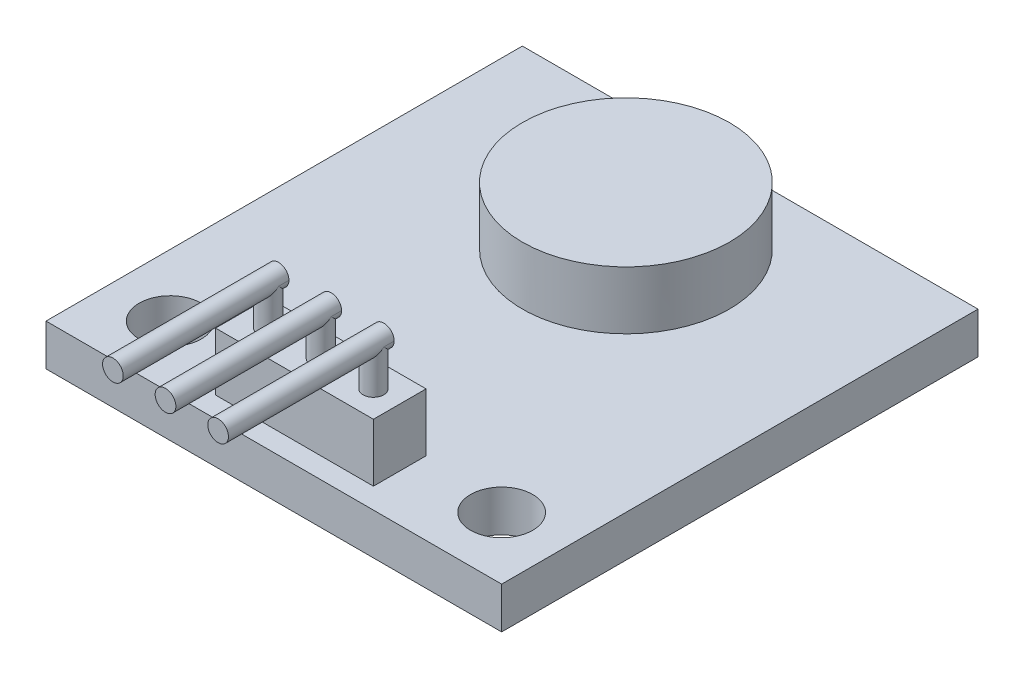
from build123d import *

# Parameters (mm, degrees)
SKETCH_1_W      = 22
SKETCH_1_H      = 23
SKETCH_1_R      = 1.5
EXTRUDE_1_DEPTH = 2
SKETCH_2_R      = 5
SKETCH_2_W      = 7.62
SKETCH_2_H      = 2.54
EXTRUDE_2_DEPTH = 2.8
SKETCH_3_R      = 0.5
EXTRUDE_3_DEPTH = 2
EXTRUDE_START   = -1.77
SKETCH_4_R      = 0.5
EXTRUDE_4_DEPTH = 8


with BuildPart() as part:
    # 草图1 → 凸台-拉伸1 (new body)
    with BuildSketch(Plane(origin=(0, 0, 0), x_dir=(1, 0, 0), z_dir=(0, 1, 0))):
        with Locations((11, 11.5)):
            Rectangle(SKETCH_1_W, SKETCH_1_H)
        with Locations(Location((19, 3, 0), (0, 0, 270))):
            Circle(SKETCH_1_R, mode=Mode.SUBTRACT)
        with Locations(Location((3, 3, 0), (0, 0, 90))):
            Circle(SKETCH_1_R, mode=Mode.SUBTRACT)
    extrude(amount=EXTRUDE_1_DEPTH)

    # 草图2 → 凸台-拉伸2 (add)
    with BuildSketch(Plane(origin=(0, 2, 0), x_dir=(1, 0, 0), z_dir=(0, 1, 0))):
        with Locations(Location((11, 17, 0), (0, 0, 90))):
            Circle(SKETCH_2_R)
        with Locations((11, 2.27)):
            Rectangle(SKETCH_2_W, SKETCH_2_H)
    extrude(amount=EXTRUDE_2_DEPTH)

    # 草图3 → 凸台-拉伸3 (add)
    with BuildSketch(Plane(origin=(0, 4.8, 0), x_dir=(1, 0, 0), z_dir=(0, 1, 0))):
        with Locations(Location((13.54, 2.27, 0), (0, 0, 90))):
            Circle(SKETCH_3_R)
        with Locations(Location((11, 2.27, 0), (0, 0, 90))):
            Circle(SKETCH_3_R)
        with Locations(Location((8.46, 2.27, 0), (0, 0, 90))):
            Circle(SKETCH_3_R)
    extrude(amount=EXTRUDE_3_DEPTH)

    # 草图4 → 凸台-拉伸4 (add)
    with BuildSketch(Plane.XY.offset(-1).offset(EXTRUDE_START)):
        with Locations((8.46, 6.8)):
            Circle(SKETCH_4_R)
        with Locations((11, 6.8)):
            Circle(SKETCH_4_R)
        with Locations((13.54, 6.8)):
            Circle(SKETCH_4_R)
    extrude(amount=EXTRUDE_4_DEPTH)


solid = part.part
